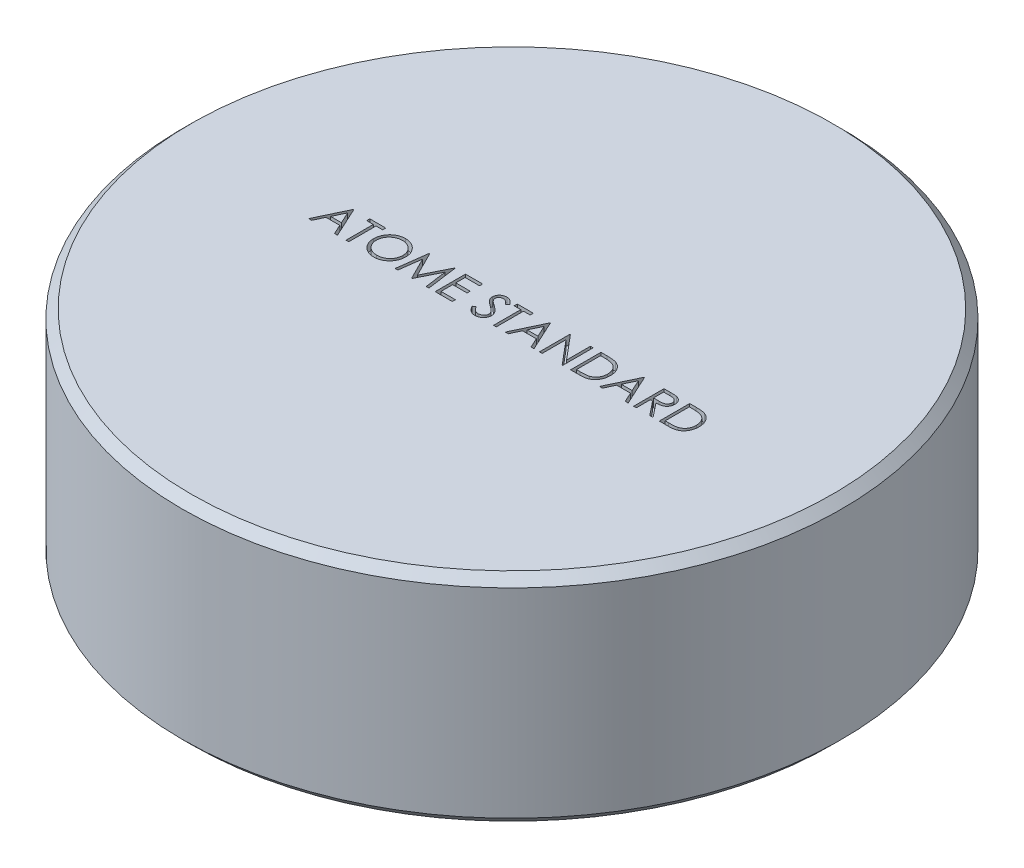
from build123d import *

# Parameters (mm, degrees)
ESQUISSE1_R             = 38
BOSS_EXTRU_1_DEPTH      = 25
CHANFREIN1_SIZE         = 1
CHANFREIN2_SIZE         = 1
ENL_V_MAT_EXTRU_1_DEPTH = 1
ENL_V_MAT_EXTRU_2_DEPTH = 1


with BuildPart() as part:
    # Esquisse1 → Boss.-Extru.1 (new body)
    with BuildSketch(Plane(origin=(0, 0, 0), x_dir=(1, 0, 0), z_dir=(0, 1, 0))):
        with Locations(Location((0, 0, 0), (0, 0, 270))):
            Circle(ESQUISSE1_R)
    extrude(amount=BOSS_EXTRU_1_DEPTH)

    # Chanfrein1
    chanfrein1_edges = [part.edges().sort_by_distance(p)[0] for p in [
        (0, 25, -38),
    ]]
    chamfer(chanfrein1_edges, length=CHANFREIN1_SIZE)

    # Chanfrein2
    chanfrein2_edges = [part.edges().sort_by_distance(p)[0] for p in [
        (0, 0, -38),
    ]]
    chamfer(chanfrein2_edges, length=CHANFREIN2_SIZE)

    # Esquisse2 → Enlèv. mat.-Extru.1 (cut)
    # profile 1 of 13: a face of its own
    with BuildSketch(Plane(origin=(0, 25, 0), x_dir=(1, 0, 0), z_dir=(0, 1, 0))):
        Polygon((-19.024411501, 0.795119678), (-17.409026885, -2.704880322), (-17.750473199, -2.704880322), (-18.267901084, -1.58308545), (-19.854539706, -1.58308545), (-20.386691148, -2.704880322), (-20.729539706, -2.704880322), (-19.069283295, 0.795119678), align=None)
        Polygon((-19.050353007, 0.112928171), (-19.68416711, -1.224111091), (-18.433365828, -1.224111091), align=None, mode=Mode.SUBTRACT)
    # profile 2 of 13: a face of its own
    with BuildSketch(Plane(origin=(0, 25, 0), x_dir=(1, 0, 0), z_dir=(0, 1, 0))):
        Polygon((-17.184667911, 0.436145319), (-17.184667911, 0.795119678), (-15.344924321, 0.795119678), (-15.344924321, 0.436145319), (-16.107744834, 0.436145319), (-16.107744834, -2.704880322), (-16.421847398, -2.704880322), (-16.421847398, 0.436145319), align=None)
    # profile 3 of 13: a face of its own
    with BuildSketch(Plane(origin=(0, 25, 0), x_dir=(1, 0, 0), z_dir=(0, 1, 0))):
        with BuildLine():
            add(Edge.make_bspline(
                [(-13.16864227, 0.884863268), (-13.103834164, 0.883221788), (-12.976545697, 0.879997787), (-12.789470799, 0.855318684), (-12.610875704, 0.812623294), (-12.439305565, 0.755760311), (-12.276812589, 0.679905926), (-12.122173696, 0.588220778), (-11.975756822, 0.479744319), (-11.839535441, 0.355315092), (-11.71487849, 0.219931638), (-11.605052604, 0.075453728), (-11.51301031, -0.077245074), (-11.437424523, -0.237705905), (-11.378125914, -0.405565873), (-11.33720687, -0.581719876), (-11.31106872, -0.765026566), (-11.308012942, -0.89005343), (-11.306462783, -0.953478079)],
                knots=[0, 0, 0, 0, 1.065120563, 2.091984664, 3.0946048, 4.079830382, 5.057816894, 6.036188127, 7.030412546, 8.04752943, 9.064399622, 10.05169764, 11.02544977, 11.989514704, 12.962713494, 13.945757189, 14.957906945, 16, 16, 16, 16], degree=3))
            add(Edge.make_bspline(
                [(-11.306462783, -0.953478079), (-11.308012715, -1.016435525), (-11.311067812, -1.140531945), (-11.337236589, -1.32267539), (-11.378277589, -1.497766086), (-11.436873855, -1.665511739), (-11.512099334, -1.826089303), (-11.604754505, -1.979076256), (-11.713895716, -2.124522755), (-11.838102567, -2.26083542), (-11.973503609, -2.385832891), (-12.118733876, -2.494751766), (-12.270527196, -2.588475891), (-12.430836904, -2.663259565), (-12.597536941, -2.723031485), (-12.772119264, -2.763784115), (-12.953765818, -2.790071159), (-13.077636821, -2.793089675), (-13.140597398, -2.794623912)],
                knots=[0, 0, 0, 0, 1.043624062, 2.057103931, 3.04512605, 4.022047818, 4.998200453, 5.980619268, 6.982898556, 8.009068085, 9.034988726, 10.034168286, 11.015286542, 11.987931943, 12.962482838, 13.94673481, 14.956375938, 16, 16, 16, 16], degree=3))
            add(Edge.make_bspline(
                [(-13.140597398, -2.794623912), (-13.204021717, -2.793074525), (-13.329047933, -2.790020271), (-13.512584968, -2.763838866), (-13.688862712, -2.722897563), (-13.857377063, -2.664388126), (-14.018221993, -2.588770896), (-14.171712076, -2.496566517), (-14.317231223, -2.387159375), (-14.453572969, -2.262992801), (-14.578322168, -2.127821249), (-14.687081543, -1.982986994), (-14.779306657, -1.831331537), (-14.854669989, -1.672434013), (-14.914334448, -1.50706257), (-14.955039267, -1.334114093), (-14.981375219, -1.154574587), (-14.984410065, -1.032331689), (-14.985949962, -0.970305002)],
                knots=[0, 0, 0, 0, 1.053102029, 2.075944431, 3.073151272, 4.055350789, 5.033113405, 6.020478099, 7.024410459, 8.052272461, 9.079885166, 10.07527673, 11.055994387, 12.023226415, 12.992069828, 13.970394897, 14.97016774, 16, 16, 16, 16], degree=3))
            add(Edge.make_bspline(
                [(-14.985949962, -0.970305002), (-14.985415327, -0.928672333), (-14.9843528, -0.845932209), (-14.971561108, -0.723065609), (-14.952999407, -0.602174951), (-14.926397494, -0.483604003), (-14.891605827, -0.367643018), (-14.8505538, -0.253492256), (-14.800413954, -0.142308532), (-14.743733306, -0.03356514), (-14.680471498, 0.071042766), (-14.610595749, 0.169922349), (-14.53656038, 0.263903346), (-14.455396987, 0.350550349), (-14.369780542, 0.432384006), (-14.278322163, 0.508146723), (-14.181579919, 0.578521674), (-14.079137539, 0.641942015), (-13.973519264, 0.69930115), (-13.864642487, 0.748523001), (-13.753985915, 0.790769062), (-13.641031267, 0.825009887), (-13.526078495, 0.852041923), (-13.40887671, 0.870449277), (-13.289519284, 0.883273595), (-13.209107965, 0.884331097), (-13.16864227, 0.884863268)],
                knots=[0, 0, 0, 0, 1.037015668, 2.060948919, 3.074880161, 4.083647147, 5.086022904, 6.090072063, 7.104153813, 8.122640571, 9.144368836, 10.147691507, 11.138137339, 12.123020368, 13.103399296, 14.087645067, 15.080126199, 16.082011238, 17.087798457, 18.072939717, 19.057185487, 20.037253025, 21.01195951, 21.997135196, 22.992090687, 24, 24, 24, 24], degree=3))
        make_face()
        with BuildLine():
            add(Edge.make_bspline(
                [(-13.15321759, 0.525888909), (-13.186432224, 0.525484018), (-13.252543957, 0.524678109), (-13.350828493, 0.514062393), (-13.447820427, 0.498932504), (-13.543539789, 0.477350983), (-13.637586078, 0.447946931), (-13.73083592, 0.414106022), (-13.822438973, 0.372884932), (-13.912092831, 0.326312227), (-13.999007906, 0.274763307), (-14.081020608, 0.21779154), (-14.158343252, 0.156732985), (-14.230786519, 0.091445148), (-14.298137691, 0.021595546), (-14.361722392, -0.05175689), (-14.418991974, -0.130708781), (-14.471477551, -0.213119188), (-14.518445391, -0.298880769), (-14.560210746, -0.387090631), (-14.594374754, -0.478468318), (-14.622237131, -0.572022476), (-14.645336942, -0.667604935), (-14.659970866, -0.765940784), (-14.670703225, -0.866535896), (-14.671463071, -0.93451775), (-14.671847398, -0.968902758)],
                knots=[0, 0, 0, 0, 1.008559885, 2.007477868, 2.99961109, 3.989939068, 4.984837346, 5.991145699, 7.001802488, 8.033829008, 9.059044045, 10.069351652, 11.065060232, 12.050310815, 13.029377138, 14.011219647, 14.996725999, 15.989392538, 16.977580475, 17.965360261, 18.951710183, 19.937753436, 20.929683414, 21.935841486, 22.955955122, 24, 24, 24, 24], degree=3))
            add(Edge.make_bspline(
                [(-14.671847398, -0.968902758), (-14.670572536, -1.019464979), (-14.668064488, -1.118936509), (-14.646106918, -1.264704653), (-14.612284944, -1.404792939), (-14.562427577, -1.538434849), (-14.500076963, -1.666779131), (-14.423050072, -1.788687236), (-14.331790987, -1.904192111), (-14.22812746, -2.01248738), (-14.114804753, -2.111333184), (-13.994472024, -2.198096592), (-13.868418416, -2.271506842), (-13.736315213, -2.331311915), (-13.598867674, -2.378701652), (-13.455190123, -2.411180284), (-13.306239664, -2.432555739), (-13.204709009, -2.434608495), (-13.15321759, -2.435649553)],
                knots=[0, 0, 0, 0, 1.032063989, 2.030389145, 3.003944642, 3.970395727, 4.937377036, 5.913328081, 6.909231446, 7.93887556, 8.970685674, 9.976071282, 10.964166581, 11.944589148, 12.933237628, 13.927779006, 14.949070134, 16, 16, 16, 16], degree=3))
            add(Edge.make_bspline(
                [(-13.15321759, -2.435649553), (-13.118608089, -2.435174049), (-13.049967052, -2.434230981), (-12.94787153, -2.424732304), (-12.847615318, -2.409500434), (-12.749339038, -2.387569779), (-12.653154227, -2.360122572), (-12.558659424, -2.327514844), (-12.466861134, -2.286833641), (-12.376601296, -2.241885689), (-12.290205054, -2.190645532), (-12.207729522, -2.135607382), (-12.131253542, -2.074638761), (-12.05886447, -2.010320949), (-11.991236781, -1.941357101), (-11.928827797, -1.867836879), (-11.871847665, -1.789296222), (-11.819382019, -1.707010816), (-11.772578756, -1.621014563), (-11.731799657, -1.532484885), (-11.697203541, -1.441639776), (-11.669275036, -1.348348204), (-11.647389574, -1.252787356), (-11.632309654, -1.154829278), (-11.621761216, -1.054669935), (-11.620966139, -0.986926079), (-11.620565347, -0.952776957)],
                knots=[0, 0, 0, 0, 1.047197238, 2.076906641, 3.100256066, 4.114471768, 5.12198147, 6.126382909, 7.136867548, 8.15857795, 9.17633901, 10.174870724, 11.156907918, 12.133735059, 13.104061851, 14.077631395, 15.04955518, 16.038496417, 17.029181396, 18.010275684, 18.986308667, 19.968651475, 20.955262928, 21.950658345, 22.966943676, 24, 24, 24, 24], degree=3))
            add(Edge.make_bspline(
                [(-11.620565347, -0.952776957), (-11.62096646, -0.918861453), (-11.621762141, -0.851583802), (-11.632304616, -0.752122984), (-11.647405506, -0.654869773), (-11.669168214, -0.56020597), (-11.697218368, -0.468107444), (-11.731805698, -0.378660697), (-11.772590998, -0.291532502), (-11.819399222, -0.206938205), (-11.872015046, -0.125763467), (-11.929509289, -0.048161054), (-11.992874637, 0.024411687), (-12.060300662, 0.093746381), (-12.133471547, 0.158364271), (-12.212055841, 0.218286791), (-12.295099519, 0.274960066), (-12.383026755, 0.326085628), (-12.473770708, 0.37329986), (-12.566884666, 0.413750863), (-12.661313766, 0.448122983), (-12.756817878, 0.477439948), (-12.854200857, 0.498847978), (-12.952804685, 0.514076028), (-13.052492944, 0.524674414), (-13.119536164, 0.525482792), (-13.15321759, 0.525888909)],
                knots=[0, 0, 0, 0, 1.02996197, 2.043119294, 3.035359645, 4.018872909, 4.991431989, 5.957985074, 6.929999688, 7.912076566, 8.892894881, 9.867085534, 10.843653904, 11.817741046, 12.803660682, 13.806313499, 14.818574707, 15.856120519, 16.894564902, 17.924820532, 18.937903209, 19.946497019, 20.957711757, 21.963978472, 22.977135795, 24, 24, 24, 24], degree=3))
        make_face(mode=Mode.SUBTRACT)
    # profile 4 of 13: a face of its own
    with BuildSketch(Plane(origin=(0, 25, 0), x_dir=(1, 0, 0), z_dir=(0, 1, 0))):
        Polygon((-10.768001244, -2.704880322), (-10.305961981, 0.795119678), (-10.261090186, 0.795119678), (-8.816078167, -2.076675194), (-7.374571757, 0.795119678), (-7.32899884, 0.795119678), (-6.86415509, -2.704880322), (-7.179659898, -2.704880322), (-7.514796116, -0.186450835), (-8.77821759, -2.704880322), (-8.849030892, -2.704880322), (-10.117360219, -0.180841861), (-10.451795315, -2.704880322), align=None)
    # profile 5 of 13: a face of its own
    with BuildSketch(Plane(origin=(0, 25, 0), x_dir=(1, 0, 0), z_dir=(0, 1, 0))):
        Polygon((-6.146206372, 0.795119678), (-4.171847398, 0.795119678), (-4.171847398, 0.436145319), (-5.832103808, 0.436145319), (-5.832103808, -0.640777758), (-4.171847398, -0.640777758), (-4.171847398, -0.999752117), (-5.832103808, -0.999752117), (-5.832103808, -2.345905963), (-4.171847398, -2.345905963), (-4.171847398, -2.704880322), (-6.146206372, -2.704880322), align=None)
    # profile 6 of 13: a face of its own
    with BuildSketch(Plane(origin=(0, 25, 0), x_dir=(1, 0, 0), z_dir=(0, 1, 0))):
        with BuildLine():
            Line((-2.556462783, -2.029700034), (-2.260589385, -1.85231622))
            add(Edge.make_bspline(
                [(-2.260589385, -1.85231622), (-2.233071148, -1.898380605), (-2.180347267, -1.986638188), (-2.092395908, -2.105896229), (-2.001262997, -2.207258386), (-1.906273663, -2.290134993), (-1.808007715, -2.35538388), (-1.705823662, -2.401586112), (-1.600065851, -2.430402087), (-1.528092029, -2.433902174), (-1.492159898, -2.435649553)],
                knots=[0, 0, 0, 0, 1.272034388, 2.437168799, 3.508375237, 4.49857839, 5.41946034, 6.295179144, 7.148887113, 8, 8, 8, 8], degree=3))
            add(Edge.make_bspline(
                [(-1.492159898, -2.435649553), (-1.461473038, -2.43479488), (-1.400636264, -2.43310049), (-1.311074021, -2.416819688), (-1.224092219, -2.391807559), (-1.141483581, -2.355986628), (-1.064387967, -2.312648142), (-0.996781272, -2.260301964), (-0.938335158, -2.201695759), (-0.890526044, -2.136313104), (-0.853846009, -2.065995955), (-0.82565394, -1.993820004), (-0.810008867, -1.918651436), (-0.807652113, -1.868040973), (-0.806462783, -1.842500514)],
                knots=[0, 0, 0, 0, 1.095163259, 2.171163733, 3.241058638, 4.321873601, 5.38011039, 6.391990106, 7.366004449, 8.327778327, 9.272591725, 10.192022065, 11.087607919, 12, 12, 12, 12], degree=3))
            add(Edge.make_bspline(
                [(-0.806462783, -1.842500514), (-0.807937093, -1.813359665), (-0.810934152, -1.754120576), (-0.836265632, -1.666720923), (-0.876114878, -1.580228353), (-0.912877522, -1.526727087), (-0.931963584, -1.498950835)],
                knots=[0, 0, 0, 0, 0.938893495, 1.908633276, 2.914225137, 4, 4, 4, 4], degree=3))
            add(Edge.make_bspline(
                [(-0.931963584, -1.498950835), (-0.947634198, -1.478904011), (-0.980532692, -1.436818213), (-1.037090205, -1.374172977), (-1.103456319, -1.309554558), (-1.177359874, -1.240495501), (-1.261492963, -1.170207705), (-1.353220477, -1.095339427), (-1.454884336, -1.01873785), (-1.526183833, -0.967365284), (-1.562973199, -0.940857886)],
                knots=[0, 0, 0, 0, 0.722233717, 1.516239348, 2.393582979, 3.351407094, 4.387010283, 5.505090956, 6.712668013, 8, 8, 8, 8], degree=3))
            add(Edge.make_bspline(
                [(-1.562973199, -0.940857886), (-1.599797195, -0.914629299), (-1.670201872, -0.864482236), (-1.768660454, -0.790057952), (-1.856704917, -0.722014083), (-1.933943934, -0.659710071), (-2.000343531, -0.603137466), (-2.056426942, -0.552839527), (-2.100765499, -0.507455966), (-2.12542108, -0.478014624), (-2.136490828, -0.464796188)],
                knots=[0, 0, 0, 0, 1.452282411, 2.77665338, 3.964542531, 5.026858415, 5.96415736, 6.766646006, 7.446254459, 8, 8, 8, 8], degree=3))
            add(Edge.make_bspline(
                [(-2.136490828, -0.464796188), (-2.151963373, -0.444195151), (-2.182392209, -0.403680447), (-2.222558215, -0.340355589), (-2.256697378, -0.275532324), (-2.28345971, -0.209036459), (-2.305995929, -0.14180153), (-2.321153859, -0.072950285), (-2.330645256, -0.002791666), (-2.331617243, 0.044421834), (-2.332103808, 0.068056377)],
                knots=[0, 0, 0, 0, 1.068054152, 2.10047183, 3.106115577, 4.101338837, 5.06977816, 6.043150881, 7.020423561, 8, 8, 8, 8], degree=3))
            add(Edge.make_bspline(
                [(-2.332103808, 0.068056377), (-2.330798599, 0.105086151), (-2.328216079, 0.178354215), (-2.306375562, 0.285385045), (-2.271902668, 0.387571463), (-2.22360778, 0.483901796), (-2.161350428, 0.571867777), (-2.089304453, 0.652481264), (-2.003492967, 0.720249846), (-1.909340344, 0.779461905), (-1.806283972, 0.82580783), (-1.698293068, 0.86076881), (-1.585195996, 0.880578068), (-1.508592862, 0.883420833), (-1.469724001, 0.884863268)],
                knots=[0, 0, 0, 0, 1.005424448, 1.989358655, 2.955360095, 3.929531133, 4.905563448, 5.876582895, 6.856512386, 7.866279853, 8.892233794, 9.918561126, 10.94386622, 12, 12, 12, 12], degree=3))
            add(Edge.make_bspline(
                [(-1.469724001, 0.884863268), (-1.4284799, 0.883440716), (-1.346458549, 0.880611715), (-1.225809333, 0.856014184), (-1.109648617, 0.815313512), (-1.016205352, 0.769124854), (-0.94307259, 0.722993438), (-0.887299858, 0.680973614), (-0.830782407, 0.632598505), (-0.773064352, 0.577739259), (-0.715123693, 0.515892508), (-0.65610024, 0.447481819), (-0.595855971, 0.372925263), (-0.557100111, 0.319700762), (-0.537232013, 0.292415351)],
                knots=[0, 0, 0, 0, 1.286793592, 2.559021753, 3.825965368, 5.121522368, 5.803751409, 6.523245864, 7.299691795, 8.125521123, 9.008227632, 9.944561021, 10.946284179, 12, 12, 12, 12], degree=3))
            Line((-0.537232013, 0.292415351), (-0.82118634, 0.07717096))
            add(Edge.make_bspline(
                [(-0.82118634, 0.07717096), (-0.838332273, 0.09925965), (-0.87135133, 0.141797304), (-0.921480817, 0.201368619), (-0.968729465, 0.255785099), (-1.015279864, 0.303050227), (-1.058673496, 0.34575236), (-1.100790538, 0.382312117), (-1.141024889, 0.413087712), (-1.1917418, 0.445931272), (-1.255459518, 0.478487776), (-1.335444055, 0.506036854), (-1.41903033, 0.522591916), (-1.475959961, 0.524780803), (-1.50478009, 0.525888909)],
                knots=[0, 0, 0, 0, 1.181633172, 2.275549214, 3.290209073, 4.226197932, 5.078386478, 5.862611352, 6.581680152, 7.217281963, 8.414376989, 9.595101626, 10.782541182, 12, 12, 12, 12], degree=3))
            add(Edge.make_bspline(
                [(-1.50478009, 0.525888909), (-1.540936613, 0.524677209), (-1.61066106, 0.522340559), (-1.709651296, 0.496820574), (-1.798745221, 0.456638714), (-1.875297786, 0.400323736), (-1.939034763, 0.333602743), (-1.985140222, 0.256823888), (-2.012890387, 0.172041485), (-2.016276666, 0.112899829), (-2.018001244, 0.082779934)],
                knots=[0, 0, 0, 0, 1.14458467, 2.207223713, 3.21896685, 4.227309161, 5.202851033, 6.127160689, 7.046193047, 8, 8, 8, 8], degree=3))
            add(Edge.make_bspline(
                [(-2.018001244, 0.082779934), (-2.017608118, 0.064028456), (-2.016821221, 0.026494836), (-2.005846424, -0.028956586), (-1.991747095, -0.084267925), (-1.969404463, -0.139190508), (-1.938559159, -0.194684867), (-1.898053984, -0.251706605), (-1.847040671, -0.310758313), (-1.807963659, -0.349165687), (-1.787332174, -0.369443623)],
                knots=[0, 0, 0, 0, 0.858281714, 1.717966888, 2.583508476, 3.4729293, 4.427298488, 5.488583878, 6.674047936, 8, 8, 8, 8], degree=3))
            add(Edge.make_bspline(
                [(-1.787332174, -0.369443623), (-1.779670801, -0.376280649), (-1.761469134, -0.392523858), (-1.728193208, -0.419116138), (-1.68425041, -0.451918911), (-1.630788209, -0.492506227), (-1.566820847, -0.539587689), (-1.492341291, -0.592561301), (-1.408179758, -0.65314676), (-1.348457842, -0.695504301), (-1.316879449, -0.717901156)],
                knots=[0, 0, 0, 0, 0.420754252, 0.999615792, 1.744751191, 2.668019286, 3.750313428, 4.999500688, 6.413464383, 8, 8, 8, 8], degree=3))
            add(Edge.make_bspline(
                [(-1.316879449, -0.717901156), (-1.278893536, -0.745542515), (-1.20533908, -0.799066177), (-1.1006815, -0.879481857), (-1.005787692, -0.958129625), (-0.920324488, -1.034507233), (-0.84344758, -1.108035326), (-0.776009859, -1.179598506), (-0.717324179, -1.248684079), (-0.65414496, -1.337256654), (-0.589587141, -1.446037738), (-0.534145633, -1.579315977), (-0.499187286, -1.713112298), (-0.49461577, -1.803039134), (-0.492360219, -1.847408367)],
                knots=[0, 0, 0, 0, 1.163667725, 2.253281268, 3.268753668, 4.215851969, 5.092017293, 5.902905408, 6.650798638, 7.335211899, 8.59617414, 9.77448103, 10.901945474, 12, 12, 12, 12], degree=3))
            add(Edge.make_bspline(
                [(-0.492360219, -1.847408367), (-0.493017357, -1.878786732), (-0.494318872, -1.940934116), (-0.509279785, -2.032189193), (-0.531199451, -2.120820062), (-0.564236685, -2.205731175), (-0.604559843, -2.288475937), (-0.655726091, -2.366883838), (-0.715033775, -2.442690236), (-0.78306754, -2.513873728), (-0.857513443, -2.579219924), (-0.936197137, -2.637348985), (-1.01924741, -2.685817309), (-1.106213727, -2.725368151), (-1.197116064, -2.756301668), (-1.291923848, -2.778714537), (-1.390793359, -2.792470248), (-1.45799384, -2.79389801), (-1.492159898, -2.794623912)],
                knots=[0, 0, 0, 0, 0.983748083, 1.948392443, 2.894712957, 3.844097841, 4.80183111, 5.778335162, 6.776009319, 7.81870978, 8.863265674, 9.881300176, 10.883814829, 11.87499822, 12.874611388, 13.892143829, 14.928324115, 16, 16, 16, 16], degree=3))
            add(Edge.make_bspline(
                [(-1.492159898, -2.794623912), (-1.518595241, -2.79411273), (-1.571133001, -2.793096805), (-1.648842483, -2.784115525), (-1.724982072, -2.771408421), (-1.798596354, -2.751234351), (-1.870633766, -2.726757374), (-1.940781, -2.696619041), (-2.009072054, -2.66050184), (-2.075889637, -2.619206815), (-2.141063812, -2.571149071), (-2.20398328, -2.515175574), (-2.266712465, -2.452830069), (-2.327399861, -2.382419506), (-2.387273006, -2.305081423), (-2.445151415, -2.22009224), (-2.502233133, -2.127914886), (-2.538048601, -2.0630498), (-2.556462783, -2.029700034)],
                knots=[0, 0, 0, 0, 0.915332311, 1.819136955, 2.706846663, 3.586547465, 4.459518054, 5.340707479, 6.227863349, 7.133153174, 8.059268498, 9.028702269, 10.047606654, 11.120612155, 12.245963614, 13.433783089, 14.680604001, 16, 16, 16, 16], degree=3))
        make_face()
    # profile 7 of 13: a face of its own
    with BuildSketch(Plane(origin=(0, 25, 0), x_dir=(1, 0, 0), z_dir=(0, 1, 0))):
        Polygon((-0.178257654, 0.436145319), (-0.178257654, 0.795119678), (1.661485935, 0.795119678), (1.661485935, 0.436145319), (0.898665422, 0.436145319), (0.898665422, -2.704880322), (0.584562858, -2.704880322), (0.584562858, 0.436145319), align=None)
    # profile 8 of 13: a face of its own
    with BuildSketch(Plane(origin=(0, 25, 0), x_dir=(1, 0, 0), z_dir=(0, 1, 0))):
        Polygon((3.63584491, 0.795119678), (5.251229525, -2.704880322), (4.909783211, -2.704880322), (4.392355326, -1.58308545), (2.805716705, -1.58308545), (2.273565262, -2.704880322), (1.930716705, -2.704880322), (3.590973115, 0.795119678), align=None)
        Polygon((3.609903403, 0.112928171), (2.976089301, -1.224111091), (4.226890583, -1.224111091), align=None, mode=Mode.SUBTRACT)
    # profile 9 of 13: a face of its own
    with BuildSketch(Plane(origin=(0, 25, 0), x_dir=(1, 0, 0), z_dir=(0, 1, 0))):
        Polygon((5.879434653, -2.704880322), (5.879434653, 0.795119678), (5.945340102, 0.795119678), (8.257639781, -1.959587854), (8.257639781, 0.795119678), (8.571742346, 0.795119678), (8.571742346, -2.704880322), (8.500227922, -2.704880322), (6.193537217, 0.043517114), (6.193537217, -2.704880322), align=None)
    # profile 10 of 13: a face of its own
    with BuildSketch(Plane(origin=(0, 25, 0), x_dir=(1, 0, 0), z_dir=(0, 1, 0))):
        with BuildLine():
            Line((9.469178243, -2.704880322), (9.469178243, 0.795119678))
            Line((9.469178243, 0.795119678), (10.175909012, 0.795119678))
            add(Edge.make_bspline(
                [(10.175909012, 0.795119678), (10.237378, 0.794677108), (10.356135766, 0.793822065), (10.527748213, 0.788400674), (10.686531976, 0.778810208), (10.831964835, 0.764840682), (10.964446047, 0.747687648), (11.083604655, 0.726187244), (11.190056798, 0.700799073), (11.255526238, 0.679153623), (11.286485935, 0.668917755)],
                knots=[0, 0, 0, 0, 1.314313732, 2.53924729, 3.670748893, 4.714932338, 5.66265055, 6.526160246, 7.303039223, 8, 8, 8, 8], degree=3))
            add(Edge.make_bspline(
                [(11.286485935, 0.668917755), (11.326980675, 0.653487049), (11.407051867, 0.622975555), (11.521058989, 0.565419254), (11.628384352, 0.500206152), (11.729603497, 0.427250289), (11.822404324, 0.344485941), (11.91041222, 0.255428855), (11.990026944, 0.156840515), (12.06293524, 0.050765527), (12.1286709, -0.061546525), (12.185810058, -0.179881634), (12.233264051, -0.303638842), (12.272657278, -0.43247399), (12.303703735, -0.566670368), (12.324885667, -0.706384234), (12.338856657, -0.851063423), (12.340260708, -0.949237887), (12.340973115, -0.999050995)],
                knots=[0, 0, 0, 0, 0.984719456, 1.947108742, 2.898477687, 3.838006223, 4.779231079, 5.722358779, 6.681677486, 7.655904652, 8.64651281, 9.637519902, 10.640069247, 11.656948941, 12.698408672, 13.768548281, 14.867775369, 16, 16, 16, 16], degree=3))
            add(Edge.make_bspline(
                [(12.340973115, -0.999050995), (12.340344147, -1.042312234), (12.339104701, -1.127563023), (12.327975385, -1.253203918), (12.311799065, -1.37511749), (12.286754867, -1.49272319), (12.256352354, -1.607051408), (12.217388203, -1.716883652), (12.172752707, -1.823227461), (12.120702828, -1.924644937), (12.063561443, -2.020728309), (12.0022397, -2.111303838), (11.936803004, -2.195079059), (11.866627371, -2.272307671), (11.792619655, -2.34287325), (11.714295324, -2.407365265), (11.631452274, -2.46452182), (11.544461551, -2.516588928), (11.450785422, -2.562009284), (11.348649556, -2.600439294), (11.237618378, -2.632285909), (11.117964421, -2.658856805), (10.989480943, -2.679934107), (10.852041977, -2.6940605), (10.705858687, -2.703613433), (10.605479422, -2.704449826), (10.55381366, -2.704880322)],
                knots=[0, 0, 0, 0, 1.105936401, 2.179363191, 3.223086493, 4.248585256, 5.251745608, 6.245858792, 7.225916811, 8.198733463, 9.158002045, 10.082870192, 10.993790845, 11.873723703, 12.748670949, 13.606408763, 14.465103618, 15.319838547, 16.196477973, 17.123216899, 18.106603292, 19.147568657, 20.255746949, 21.433717677, 22.679120308, 24, 24, 24, 24], degree=3))
            Line((10.55381366, -2.704880322), (9.469178243, -2.704880322))
        make_face()
        with BuildLine():
            Line((9.783280807, -2.345905963), (10.185023596, -2.345905963))
            add(Edge.make_bspline(
                [(10.185023596, -2.345905963), (10.242751966, -2.345657867), (10.353784765, -2.345180687), (10.513442762, -2.340993484), (10.659322158, -2.334151546), (10.791443668, -2.324576468), (10.909732692, -2.311907853), (11.014436442, -2.29778295), (11.1052117, -2.280185499), (11.160141137, -2.26423454), (11.185524397, -2.256863495)],
                knots=[0, 0, 0, 0, 1.375205317, 2.645023457, 3.804390687, 4.853969522, 5.800190428, 6.637939096, 7.370582563, 8, 8, 8, 8], degree=3))
            add(Edge.make_bspline(
                [(11.185524397, -2.256863495), (11.217472759, -2.245611937), (11.280606397, -2.223377564), (11.371487482, -2.182819903), (11.456244487, -2.134777833), (11.536354512, -2.081375559), (11.610681168, -2.020729557), (11.680105284, -1.954158568), (11.744487085, -1.881323793), (11.803161393, -1.802315631), (11.855669697, -1.717625836), (11.901140927, -1.628087002), (11.940992458, -1.534680192), (11.972271051, -1.435971033), (11.996786635, -1.332841975), (12.014151323, -1.225285762), (12.024966048, -1.11332248), (12.026227496, -1.037170355), (12.026870551, -0.998349873)],
                knots=[0, 0, 0, 0, 0.998632004, 1.973411704, 2.929992603, 3.868527914, 4.809262121, 5.754881198, 6.702106254, 7.672490631, 8.653608572, 9.636854334, 10.631411391, 11.644891563, 12.686317036, 13.754757253, 14.855430412, 16, 16, 16, 16], degree=3))
            add(Edge.make_bspline(
                [(12.026870551, -0.998349873), (12.026357263, -0.957416393), (12.025348906, -0.877002209), (12.012674595, -0.759011514), (11.99415304, -0.645530863), (11.967369354, -0.536552668), (11.933238475, -0.431864315), (11.890643833, -0.332044805), (11.841977214, -0.236039936), (11.784073877, -0.146065571), (11.720658284, -0.060972461), (11.650280404, 0.016982454), (11.574058366, 0.087976754), (11.492823516, 0.153116067), (11.404286417, 0.209779743), (11.310532726, 0.260466424), (11.210187055, 0.303482315), (11.140374359, 0.326361178), (11.10489539, 0.337988268)],
                knots=[0, 0, 0, 0, 1.122418816, 2.205001699, 3.251619955, 4.274784885, 5.280384055, 6.268708349, 7.249350384, 8.229342522, 9.199999885, 10.157847722, 11.105861043, 12.055065948, 13.010012805, 13.98527497, 14.976112212, 16, 16, 16, 16], degree=3))
            add(Edge.make_bspline(
                [(11.10489539, 0.337988268), (11.075544244, 0.346104695), (11.013135654, 0.363362448), (10.91129619, 0.382187821), (10.79668104, 0.39879232), (10.668781339, 0.412850359), (10.52774288, 0.42293768), (10.373457192, 0.430508995), (10.205857588, 0.435615627), (10.089675054, 0.435964335), (10.029374557, 0.436145319)],
                knots=[0, 0, 0, 0, 0.674548936, 1.434276114, 2.292660221, 3.240891867, 4.284742987, 5.42552168, 6.663806718, 8, 8, 8, 8], degree=3))
            Line((10.029374557, 0.436145319), (9.783280807, 0.436145319))
            Line((9.783280807, 0.436145319), (9.783280807, -2.345905963))
        make_face(mode=Mode.SUBTRACT)
    # profile 11 of 13: a face of its own
    with BuildSketch(Plane(origin=(0, 25, 0), x_dir=(1, 0, 0), z_dir=(0, 1, 0))):
        Polygon((14.494819269, 0.795119678), (16.110203884, -2.704880322), (15.76875757, -2.704880322), (15.251329685, -1.58308545), (13.664691064, -1.58308545), (13.132539621, -2.704880322), (12.789691064, -2.704880322), (14.449947474, 0.795119678), align=None)
        Polygon((14.468877762, 0.112928171), (13.83506366, -1.224111091), (15.085864942, -1.224111091), align=None, mode=Mode.SUBTRACT)
    # profile 12 of 13: a face of its own
    with BuildSketch(Plane(origin=(0, 25, 0), x_dir=(1, 0, 0), z_dir=(0, 1, 0))):
        with BuildLine():
            Line((16.738409012, 0.795119678), (17.438829685, 0.795119678))
            add(Edge.make_bspline(
                [(17.438829685, 0.795119678), (17.485570814, 0.794964092), (17.575318958, 0.79466535), (17.703892229, 0.792999587), (17.820719326, 0.788225231), (17.925739165, 0.784116647), (18.01894982, 0.776624706), (18.100637111, 0.769464059), (18.170424808, 0.760090398), (18.212670659, 0.751384975), (18.231798435, 0.747443396)],
                knots=[0, 0, 0, 0, 1.410062039, 2.707475311, 3.878576406, 4.937260626, 5.877586885, 6.699081471, 7.410979367, 8, 8, 8, 8], degree=3))
            add(Edge.make_bspline(
                [(18.231798435, 0.747443396), (18.257405059, 0.74111663), (18.308072049, 0.728598067), (18.381022115, 0.702138466), (18.450536439, 0.671518841), (18.516326263, 0.635555121), (18.578062054, 0.593980341), (18.636380365, 0.547512219), (18.691545829, 0.496405013), (18.741327459, 0.439370172), (18.78826651, 0.379533662), (18.827855137, 0.314829905), (18.861981617, 0.247168378), (18.889152134, 0.17586096), (18.911030107, 0.101599188), (18.926456347, 0.023710391), (18.935707534, -0.057450584), (18.93664939, -0.112808493), (18.937126961, -0.140877918)],
                knots=[0, 0, 0, 0, 1.027469482, 2.033020251, 3.019912614, 3.986113645, 4.951240523, 5.91722682, 6.890402269, 7.87763091, 8.8651537, 9.85103654, 10.82876324, 11.815024772, 12.821070561, 13.842952187, 14.906261191, 16, 16, 16, 16], degree=3))
            add(Edge.make_bspline(
                [(18.937126961, -0.140877918), (18.935657963, -0.187513023), (18.932791567, -0.278510191), (18.906066463, -0.410571072), (18.862289944, -0.533760387), (18.801966655, -0.647923025), (18.725147179, -0.75083367), (18.632822388, -0.841224125), (18.524940776, -0.916864038), (18.42451146, -0.969316843), (18.335797261, -1.002909751), (18.262763948, -1.02654611), (18.18309697, -1.044808076), (18.097559636, -1.061168207), (18.00579598, -1.073519902), (17.908025941, -1.082566496), (17.804179789, -1.088220545), (17.73284072, -1.08906255), (17.696141384, -1.089495707)],
                knots=[0, 0, 0, 0, 1.260483769, 2.459530307, 3.627416485, 4.787058657, 5.939039949, 7.08810263, 8.267026773, 9.491475466, 10.141966685, 10.831826277, 11.566392101, 12.351337768, 13.187381173, 14.07005841, 15.007169909, 16, 16, 16, 16], degree=3))
            Line((17.696141384, -1.089495707), (18.981998756, -2.704880322))
            Line((18.981998756, -2.704880322), (18.593577281, -2.704880322))
            Line((18.593577281, -2.704880322), (17.30771991, -1.089495707))
            Line((17.30771991, -1.089495707), (17.052511576, -1.089495707))
            Line((17.052511576, -1.089495707), (17.052511576, -2.704880322))
            Line((17.052511576, -2.704880322), (16.738409012, -2.704880322))
            Line((16.738409012, -2.704880322), (16.738409012, 0.795119678))
        make_face()
        with BuildLine():
            Line((17.052511576, 0.436145319), (17.052511576, -0.730521348))
            Line((17.052511576, -0.730521348), (17.693336897, -0.7354292))
            add(Edge.make_bspline(
                [(17.693336897, -0.7354292), (17.723256936, -0.735442437), (17.781250493, -0.735468093), (17.865151158, -0.731474317), (17.943271269, -0.726930999), (18.015312022, -0.719981653), (18.081305597, -0.711025582), (18.14121901, -0.699822597), (18.195150062, -0.686770535), (18.2580486, -0.666568909), (18.328285132, -0.634562891), (18.404616592, -0.587997392), (18.469618929, -0.529428273), (18.524536792, -0.462454817), (18.568666223, -0.388818568), (18.599778278, -0.309402199), (18.61952072, -0.226210601), (18.621849265, -0.169032493), (18.623024397, -0.140176797)],
                knots=[0, 0, 0, 0, 1.146690395, 2.22261258, 3.21895312, 4.145990853, 4.996080663, 5.770904154, 6.481378293, 7.121626537, 8.300444488, 9.431385265, 10.535395872, 11.636531494, 12.74115979, 13.810798291, 14.895190096, 16, 16, 16, 16], degree=3))
            add(Edge.make_bspline(
                [(18.623024397, -0.140176797), (18.621822276, -0.112030223), (18.61944011, -0.056253984), (18.599991342, 0.025401926), (18.567101961, 0.102468876), (18.522779723, 0.174633361), (18.468780568, 0.240139097), (18.405462755, 0.29618625), (18.33455756, 0.342435715), (18.268286361, 0.371990095), (18.209052149, 0.390109949), (18.157622489, 0.402861112), (18.099511011, 0.413105581), (18.034435553, 0.421313642), (17.962673922, 0.428368587), (17.883863271, 0.433120365), (17.79852649, 0.435934229), (17.739379559, 0.436073318), (17.708761576, 0.436145319)],
                knots=[0, 0, 0, 0, 1.101028733, 2.181837193, 3.264309656, 4.369019818, 5.486613113, 6.575447106, 7.666700264, 8.788928104, 9.402425223, 10.0903467, 10.862060571, 11.710948788, 12.657782767, 13.684531032, 14.801375019, 16, 16, 16, 16], degree=3))
            Line((17.708761576, 0.436145319), (17.052511576, 0.436145319))
        make_face(mode=Mode.SUBTRACT)
    # profile 13 of 13: a face of its own
    with BuildSketch(Plane(origin=(0, 25, 0), x_dir=(1, 0, 0), z_dir=(0, 1, 0))):
        with BuildLine():
            Line((19.699947474, -2.704880322), (19.699947474, 0.795119678))
            Line((19.699947474, 0.795119678), (20.406678243, 0.795119678))
            add(Edge.make_bspline(
                [(20.406678243, 0.795119678), (20.468147231, 0.794677108), (20.586904997, 0.793822065), (20.758517444, 0.788400674), (20.917301206, 0.778810208), (21.062734066, 0.764840682), (21.195215278, 0.747687648), (21.314373886, 0.726187244), (21.420826029, 0.700799073), (21.486295469, 0.679153623), (21.517255166, 0.668917755)],
                knots=[0, 0, 0, 0, 1.314313732, 2.53924729, 3.670748893, 4.714932338, 5.66265055, 6.526160246, 7.303039223, 8, 8, 8, 8], degree=3))
            add(Edge.make_bspline(
                [(21.517255166, 0.668917755), (21.557749905, 0.653487049), (21.637821098, 0.622975555), (21.75182822, 0.565419254), (21.859153583, 0.500206152), (21.960372728, 0.427250289), (22.053173554, 0.344485941), (22.141181451, 0.255428855), (22.220796175, 0.156840515), (22.293704471, 0.050765527), (22.359440131, -0.061546525), (22.416579288, -0.179881634), (22.464033282, -0.303638842), (22.503426508, -0.43247399), (22.534472966, -0.566670368), (22.555654898, -0.706384234), (22.569625887, -0.851063423), (22.571029939, -0.949237887), (22.571742346, -0.999050995)],
                knots=[0, 0, 0, 0, 0.984719456, 1.947108742, 2.898477687, 3.838006223, 4.779231079, 5.722358779, 6.681677486, 7.655904652, 8.64651281, 9.637519902, 10.640069247, 11.656948941, 12.698408672, 13.768548281, 14.867775369, 16, 16, 16, 16], degree=3))
            add(Edge.make_bspline(
                [(22.571742346, -0.999050995), (22.571113378, -1.042312234), (22.569873932, -1.127563023), (22.558744616, -1.253203918), (22.542568296, -1.37511749), (22.517524098, -1.49272319), (22.487121585, -1.607051408), (22.448157434, -1.716883652), (22.403521937, -1.823227461), (22.351472059, -1.924644937), (22.294330674, -2.020728309), (22.233008931, -2.111303838), (22.167572235, -2.195079059), (22.097396602, -2.272307671), (22.023388886, -2.34287325), (21.945064555, -2.407365265), (21.862221504, -2.46452182), (21.775230782, -2.516588928), (21.681554653, -2.562009284), (21.579418786, -2.600439294), (21.468387608, -2.632285909), (21.348733651, -2.658856805), (21.220250174, -2.679934107), (21.082811208, -2.6940605), (20.936627918, -2.703613433), (20.836248653, -2.704449826), (20.78458289, -2.704880322)],
                knots=[0, 0, 0, 0, 1.105936401, 2.179363191, 3.223086493, 4.248585256, 5.251745608, 6.245858792, 7.225916811, 8.198733463, 9.158002045, 10.082870192, 10.993790845, 11.873723703, 12.748670949, 13.606408763, 14.465103618, 15.319838547, 16.196477973, 17.123216899, 18.106603292, 19.147568657, 20.255746949, 21.433717677, 22.679120308, 24, 24, 24, 24], degree=3))
            Line((20.78458289, -2.704880322), (19.699947474, -2.704880322))
        make_face()
        with BuildLine():
            Line((20.014050038, -2.345905963), (20.415792826, -2.345905963))
            add(Edge.make_bspline(
                [(20.415792826, -2.345905963), (20.473521197, -2.345657867), (20.584553995, -2.345180687), (20.744211993, -2.340993484), (20.890091389, -2.334151546), (21.022212899, -2.324576468), (21.140501923, -2.311907853), (21.245205673, -2.29778295), (21.335980931, -2.280185499), (21.390910368, -2.26423454), (21.416293628, -2.256863495)],
                knots=[0, 0, 0, 0, 1.375205317, 2.645023457, 3.804390687, 4.853969522, 5.800190428, 6.637939096, 7.370582563, 8, 8, 8, 8], degree=3))
            add(Edge.make_bspline(
                [(21.416293628, -2.256863495), (21.44824199, -2.245611937), (21.511375628, -2.223377564), (21.602256713, -2.182819903), (21.687013718, -2.134777833), (21.767123743, -2.081375559), (21.841450398, -2.020729557), (21.910874515, -1.954158568), (21.975256316, -1.881323793), (22.033930624, -1.802315631), (22.086438928, -1.717625836), (22.131910158, -1.628087002), (22.171761689, -1.534680192), (22.203040282, -1.435971033), (22.227555866, -1.332841975), (22.244920554, -1.225285762), (22.255735278, -1.11332248), (22.256996726, -1.037170355), (22.257639781, -0.998349873)],
                knots=[0, 0, 0, 0, 0.998632004, 1.973411704, 2.929992603, 3.868527914, 4.809262121, 5.754881198, 6.702106254, 7.672490631, 8.653608572, 9.636854334, 10.631411391, 11.644891563, 12.686317036, 13.754757253, 14.855430412, 16, 16, 16, 16], degree=3))
            add(Edge.make_bspline(
                [(22.257639781, -0.998349873), (22.257126494, -0.957416393), (22.256118137, -0.877002209), (22.243443826, -0.759011514), (22.224922271, -0.645530863), (22.198138585, -0.536552668), (22.164007706, -0.431864315), (22.121413064, -0.332044805), (22.072746445, -0.236039936), (22.014843108, -0.146065571), (21.951427515, -0.060972461), (21.881049635, 0.016982454), (21.804827597, 0.087976754), (21.723592747, 0.153116067), (21.635055648, 0.209779743), (21.541301957, 0.260466424), (21.440956286, 0.303482315), (21.37114359, 0.326361178), (21.335664621, 0.337988268)],
                knots=[0, 0, 0, 0, 1.122418816, 2.205001699, 3.251619955, 4.274784885, 5.280384055, 6.268708349, 7.249350384, 8.229342522, 9.199999885, 10.157847722, 11.105861043, 12.055065948, 13.010012805, 13.98527497, 14.976112212, 16, 16, 16, 16], degree=3))
            add(Edge.make_bspline(
                [(21.335664621, 0.337988268), (21.306313475, 0.346104695), (21.243904885, 0.363362448), (21.142065421, 0.382187821), (21.027450271, 0.39879232), (20.89955057, 0.412850359), (20.758512111, 0.42293768), (20.604226423, 0.430508995), (20.436626818, 0.435615627), (20.320444284, 0.435964335), (20.260143788, 0.436145319)],
                knots=[0, 0, 0, 0, 0.674548936, 1.434276114, 2.292660221, 3.240891867, 4.284742987, 5.42552168, 6.663806718, 8, 8, 8, 8], degree=3))
            Line((20.260143788, 0.436145319), (20.014050038, 0.436145319))
            Line((20.014050038, 0.436145319), (20.014050038, -2.345905963))
        make_face(mode=Mode.SUBTRACT)
    extrude(amount=-ENL_V_MAT_EXTRU_1_DEPTH, mode=Mode.SUBTRACT)

    # Esquisse3 → Enlèv. mat.-Extru.2 (cut)
    # profile 1 of 13: a face of its own
    with BuildSketch(Plane.XZ):
        Polygon((-16.015368156, -3.437714595), (-14.399983541, -6.937714595), (-14.741429855, -6.937714595), (-15.25885774, -5.815919723), (-16.845496362, -5.815919723), (-17.377647804, -6.937714595), (-17.720496362, -6.937714595), (-16.060239951, -3.437714595), align=None)
        Polygon((-16.041309663, -4.119906102), (-16.675123765, -5.456945364), (-15.424322483, -5.456945364), align=None, mode=Mode.SUBTRACT)
    # profile 2 of 13: a face of its own
    with BuildSketch(Plane.XZ):
        Polygon((-14.175624567, -3.796688954), (-14.175624567, -3.437714595), (-12.335880977, -3.437714595), (-12.335880977, -3.796688954), (-13.09870149, -3.796688954), (-13.09870149, -6.937714595), (-13.412804054, -6.937714595), (-13.412804054, -3.796688954), align=None)
    # profile 3 of 13: a face of its own
    with BuildSketch(Plane.XZ):
        with BuildLine():
            add(Edge.make_bspline(
                [(-10.159598926, -3.347971006), (-10.09479082, -3.349612485), (-9.967502353, -3.352836486), (-9.780427455, -3.377515589), (-9.60183236, -3.420210979), (-9.430262221, -3.477073962), (-9.267769244, -3.552928347), (-9.113130352, -3.644613496), (-8.966713478, -3.753089954), (-8.830492097, -3.877519181), (-8.705835146, -4.012902635), (-8.59600926, -4.157380545), (-8.503966966, -4.310079347), (-8.428381179, -4.470540178), (-8.369082569, -4.638400146), (-8.328163526, -4.814554149), (-8.302025376, -4.997860839), (-8.298969598, -5.122887704), (-8.297419439, -5.186312352)],
                knots=[0, 0, 0, 0, 1.065120563, 2.091984664, 3.0946048, 4.079830382, 5.057816894, 6.036188127, 7.030412546, 8.04752943, 9.064399622, 10.05169764, 11.02544977, 11.989514704, 12.962713494, 13.945757189, 14.957906945, 16, 16, 16, 16], degree=3))
            add(Edge.make_bspline(
                [(-8.297419439, -5.186312352), (-8.298969371, -5.249269798), (-8.302024468, -5.373366218), (-8.328193245, -5.555509663), (-8.369234245, -5.730600359), (-8.427830511, -5.898346012), (-8.50305599, -6.058923576), (-8.595711161, -6.21191053), (-8.704852372, -6.357357028), (-8.829059223, -6.493669693), (-8.964460265, -6.618667164), (-9.109690532, -6.72758604), (-9.261483851, -6.821310164), (-9.42179356, -6.896093838), (-9.588493596, -6.955865759), (-9.76307592, -6.996618389), (-9.944722474, -7.022905432), (-10.068593477, -7.025923948), (-10.131554054, -7.027458185)],
                knots=[0, 0, 0, 0, 1.043624062, 2.057103931, 3.04512605, 4.022047818, 4.998200453, 5.980619268, 6.982898556, 8.009068085, 9.034988726, 10.034168286, 11.015286542, 11.987931943, 12.962482838, 13.94673481, 14.956375938, 16, 16, 16, 16], degree=3))
            add(Edge.make_bspline(
                [(-10.131554054, -7.027458185), (-10.194978373, -7.025908798), (-10.320004589, -7.022854544), (-10.503541624, -6.996673139), (-10.679819368, -6.955731836), (-10.848333719, -6.897222399), (-11.009178649, -6.821605169), (-11.162668732, -6.72940079), (-11.308187879, -6.619993648), (-11.444529625, -6.495827074), (-11.569278823, -6.360655522), (-11.678038199, -6.215821267), (-11.770263312, -6.06416581), (-11.845626645, -5.905268286), (-11.905291104, -5.739896843), (-11.945995922, -5.566948366), (-11.972331875, -5.38740886), (-11.975366721, -5.265165962), (-11.976906618, -5.203139275)],
                knots=[0, 0, 0, 0, 1.053102029, 2.075944431, 3.073151272, 4.055350789, 5.033113405, 6.020478099, 7.024410459, 8.052272461, 9.079885166, 10.07527673, 11.055994387, 12.023226415, 12.992069828, 13.970394897, 14.97016774, 16, 16, 16, 16], degree=3))
            add(Edge.make_bspline(
                [(-11.976906618, -5.203139275), (-11.976371983, -5.161506606), (-11.975309456, -5.078766482), (-11.962517764, -4.955899882), (-11.943956062, -4.835009224), (-11.91735415, -4.716438276), (-11.882562483, -4.600477292), (-11.841510456, -4.486326529), (-11.79137061, -4.375142805), (-11.734689962, -4.266399413), (-11.671428154, -4.161791507), (-11.601552405, -4.062911924), (-11.527517036, -3.968930927), (-11.446353643, -3.882283924), (-11.360737197, -3.800450267), (-11.269278819, -3.72468755), (-11.172536575, -3.654312599), (-11.070094195, -3.590892258), (-10.96447592, -3.533533124), (-10.855599142, -3.484311273), (-10.744942571, -3.442065211), (-10.631987923, -3.407824386), (-10.517035151, -3.38079235), (-10.399833366, -3.362384996), (-10.28047594, -3.349560678), (-10.200064621, -3.348503176), (-10.159598926, -3.347971006)],
                knots=[0, 0, 0, 0, 1.037015668, 2.060948919, 3.074880161, 4.083647147, 5.086022904, 6.090072063, 7.104153813, 8.122640571, 9.144368836, 10.147691507, 11.138137339, 12.123020368, 13.103399296, 14.087645067, 15.080126199, 16.082011238, 17.087798457, 18.072939717, 19.057185487, 20.037253025, 21.01195951, 21.997135196, 22.992090687, 24, 24, 24, 24], degree=3))
        make_face()
        with BuildLine():
            add(Edge.make_bspline(
                [(-10.144174246, -3.706945364), (-10.17738888, -3.707350255), (-10.243500613, -3.708156164), (-10.341785149, -3.71877188), (-10.438777083, -3.733901769), (-10.534496445, -3.75548329), (-10.628542734, -3.784887343), (-10.721792576, -3.818728251), (-10.813395629, -3.859949341), (-10.903049487, -3.906522046), (-10.989964562, -3.958070967), (-11.071977264, -4.015042734), (-11.149299908, -4.076101288), (-11.221743174, -4.141389125), (-11.289094347, -4.211238727), (-11.352679048, -4.284591163), (-11.40994863, -4.363543054), (-11.462434207, -4.445953461), (-11.509402047, -4.531715042), (-11.551167402, -4.619924904), (-11.58533141, -4.711302591), (-11.613193787, -4.804856749), (-11.636293597, -4.900439208), (-11.650927522, -4.998775057), (-11.661659881, -5.099370169), (-11.662419726, -5.167352023), (-11.662804054, -5.201737031)],
                knots=[0, 0, 0, 0, 1.008559885, 2.007477868, 2.99961109, 3.989939068, 4.984837346, 5.991145699, 7.001802488, 8.033829008, 9.059044045, 10.069351652, 11.065060232, 12.050310815, 13.029377138, 14.011219647, 14.996725999, 15.989392538, 16.977580475, 17.965360261, 18.951710183, 19.937753436, 20.929683414, 21.935841486, 22.955955122, 24, 24, 24, 24], degree=3))
            add(Edge.make_bspline(
                [(-11.662804054, -5.201737031), (-11.661529192, -5.252299252), (-11.659021144, -5.351770782), (-11.637063574, -5.497538926), (-11.6032416, -5.637627212), (-11.553384233, -5.771269122), (-11.491033618, -5.899613405), (-11.414006728, -6.021521509), (-11.322747643, -6.137026384), (-11.219084116, -6.245321653), (-11.105761409, -6.344167457), (-10.985428679, -6.430930865), (-10.859375072, -6.504341115), (-10.727271869, -6.564146188), (-10.58982433, -6.611535925), (-10.446146779, -6.644014557), (-10.29719632, -6.665390012), (-10.195665664, -6.667442768), (-10.144174246, -6.668483826)],
                knots=[0, 0, 0, 0, 1.032063989, 2.030389145, 3.003944642, 3.970395727, 4.937377036, 5.913328081, 6.909231446, 7.93887556, 8.970685674, 9.976071282, 10.964166581, 11.944589148, 12.933237628, 13.927779006, 14.949070134, 16, 16, 16, 16], degree=3))
            add(Edge.make_bspline(
                [(-10.144174246, -6.668483826), (-10.109564745, -6.668008322), (-10.040923708, -6.667065254), (-9.938828186, -6.657566577), (-9.838571974, -6.642334707), (-9.740295694, -6.620404052), (-9.644110883, -6.592956845), (-9.54961608, -6.560349117), (-9.457817789, -6.519667914), (-9.367557952, -6.474719962), (-9.28116171, -6.423479805), (-9.198686178, -6.368441655), (-9.122210198, -6.307473034), (-9.049821126, -6.243155222), (-8.982193437, -6.174191374), (-8.919784453, -6.100671152), (-8.862804321, -6.022130495), (-8.810338674, -5.939845089), (-8.763535412, -5.853848836), (-8.722756313, -5.765319158), (-8.688160197, -5.674474049), (-8.660231692, -5.581182478), (-8.63834623, -5.485621629), (-8.62326631, -5.387663551), (-8.612717872, -5.287504208), (-8.611922795, -5.219760352), (-8.611522003, -5.18561123)],
                knots=[0, 0, 0, 0, 1.047197238, 2.076906641, 3.100256066, 4.114471768, 5.12198147, 6.126382909, 7.136867548, 8.15857795, 9.17633901, 10.174870724, 11.156907918, 12.133735059, 13.104061851, 14.077631395, 15.04955518, 16.038496417, 17.029181396, 18.010275684, 18.986308667, 19.968651475, 20.955262928, 21.950658345, 22.966943676, 24, 24, 24, 24], degree=3))
            add(Edge.make_bspline(
                [(-8.611522003, -5.18561123), (-8.611923116, -5.151695726), (-8.612718797, -5.084418075), (-8.623261272, -4.984957257), (-8.638362162, -4.887704046), (-8.66012487, -4.793040243), (-8.688175024, -4.700941718), (-8.722762354, -4.61149497), (-8.763547654, -4.524366775), (-8.810355878, -4.439772478), (-8.862971702, -4.35859774), (-8.920465945, -4.280995327), (-8.983831293, -4.208422586), (-9.051257318, -4.139087892), (-9.124428203, -4.074470002), (-9.203012497, -4.014547482), (-9.286056175, -3.957874207), (-9.373983411, -3.906748645), (-9.464727364, -3.859534413), (-9.557841322, -3.81908341), (-9.652270422, -3.78471129), (-9.747774534, -3.755394325), (-9.845157513, -3.733986295), (-9.943761341, -3.718758245), (-10.0434496, -3.708159859), (-10.11049282, -3.707351481), (-10.144174246, -3.706945364)],
                knots=[0, 0, 0, 0, 1.02996197, 2.043119294, 3.035359645, 4.018872909, 4.991431989, 5.957985074, 6.929999688, 7.912076566, 8.892894881, 9.867085534, 10.843653904, 11.817741046, 12.803660682, 13.806313499, 14.818574707, 15.856120519, 16.894564902, 17.924820532, 18.937903209, 19.946497019, 20.957711757, 21.963978472, 22.977135795, 24, 24, 24, 24], degree=3))
        make_face(mode=Mode.SUBTRACT)
    # profile 4 of 13: a face of its own
    with BuildSketch(Plane.XZ):
        Polygon((-7.7589579, -6.937714595), (-7.296918637, -3.437714595), (-7.252046842, -3.437714595), (-5.807034823, -6.309509467), (-4.365528413, -3.437714595), (-4.319955496, -3.437714595), (-3.855111746, -6.937714595), (-4.170616554, -6.937714595), (-4.505752772, -4.419285108), (-5.769174246, -6.937714595), (-5.839987548, -6.937714595), (-7.108316874, -4.413676134), (-7.442751971, -6.937714595), align=None)
    # profile 5 of 13: a face of its own
    with BuildSketch(Plane.XZ):
        Polygon((-3.137163028, -3.437714595), (-1.162804054, -3.437714595), (-1.162804054, -3.796688954), (-2.823060464, -3.796688954), (-2.823060464, -4.873612031), (-1.162804054, -4.873612031), (-1.162804054, -5.23258639), (-2.823060464, -5.23258639), (-2.823060464, -6.578740236), (-1.162804054, -6.578740236), (-1.162804054, -6.937714595), (-3.137163028, -6.937714595), align=None)
    # profile 6 of 13: a face of its own
    with BuildSketch(Plane.XZ):
        with BuildLine():
            Line((0.452580561, -6.262534307), (0.748453959, -6.085150493))
            add(Edge.make_bspline(
                [(0.748453959, -6.085150493), (0.775972196, -6.131214878), (0.828696077, -6.219472462), (0.916647436, -6.338730502), (1.007780347, -6.440092659), (1.102769681, -6.522969266), (1.201035629, -6.588218153), (1.303219683, -6.634420385), (1.408977493, -6.66323636), (1.480951315, -6.666736447), (1.516883446, -6.668483826)],
                knots=[0, 0, 0, 0, 1.272034388, 2.437168799, 3.508375237, 4.49857839, 5.41946034, 6.295179144, 7.148887113, 8, 8, 8, 8], degree=3))
            add(Edge.make_bspline(
                [(1.516883446, -6.668483826), (1.547570307, -6.667629154), (1.60840708, -6.665934763), (1.697969323, -6.649653961), (1.784951125, -6.624641832), (1.867559763, -6.588820901), (1.944655377, -6.545482415), (2.012262072, -6.493136238), (2.070708186, -6.434530032), (2.1185173, -6.369147377), (2.155197335, -6.298830229), (2.183389404, -6.226654277), (2.199034478, -6.151485709), (2.201391231, -6.100875246), (2.202580561, -6.075334788)],
                knots=[0, 0, 0, 0, 1.095163259, 2.171163733, 3.241058638, 4.321873601, 5.38011039, 6.391990106, 7.366004449, 8.327778327, 9.272591725, 10.192022065, 11.087607919, 12, 12, 12, 12], degree=3))
            add(Edge.make_bspline(
                [(2.202580561, -6.075334788), (2.201106251, -6.046193938), (2.198109193, -5.986954849), (2.172777712, -5.899555196), (2.132928466, -5.813062626), (2.096165822, -5.75956136), (2.07707976, -5.731785108)],
                knots=[0, 0, 0, 0, 0.938893495, 1.908633276, 2.914225137, 4, 4, 4, 4], degree=3))
            add(Edge.make_bspline(
                [(2.07707976, -5.731785108), (2.061409146, -5.711738284), (2.028510652, -5.669652486), (1.971953139, -5.60700725), (1.905587025, -5.542388831), (1.83168347, -5.473329775), (1.747550381, -5.403041978), (1.655822867, -5.3281737), (1.554159008, -5.251572123), (1.482859511, -5.200199557), (1.446070145, -5.173692159)],
                knots=[0, 0, 0, 0, 0.722233717, 1.516239348, 2.393582979, 3.351407094, 4.387010283, 5.505090956, 6.712668013, 8, 8, 8, 8], degree=3))
            add(Edge.make_bspline(
                [(1.446070145, -5.173692159), (1.409246149, -5.147463572), (1.338841472, -5.09731651), (1.24038289, -5.022892225), (1.152338427, -4.954848356), (1.07509941, -4.892544344), (1.008699813, -4.835971739), (0.952616402, -4.7856738), (0.908277845, -4.740290239), (0.883622265, -4.710848897), (0.872552517, -4.697630461)],
                knots=[0, 0, 0, 0, 1.452282411, 2.77665338, 3.964542531, 5.026858415, 5.96415736, 6.766646006, 7.446254459, 8, 8, 8, 8], degree=3))
            add(Edge.make_bspline(
                [(0.872552517, -4.697630461), (0.857079971, -4.677029424), (0.826651135, -4.63651472), (0.786485129, -4.573189862), (0.752345966, -4.508366597), (0.725583634, -4.441870732), (0.703047415, -4.374635803), (0.687889485, -4.305784558), (0.678398088, -4.235625939), (0.677426101, -4.188412439), (0.676939536, -4.164777897)],
                knots=[0, 0, 0, 0, 1.068054152, 2.10047183, 3.106115577, 4.101338837, 5.06977816, 6.043150881, 7.020423561, 8, 8, 8, 8], degree=3))
            add(Edge.make_bspline(
                [(0.676939536, -4.164777897), (0.678244745, -4.127748122), (0.680827265, -4.054480058), (0.702667782, -3.947449228), (0.737140676, -3.845262811), (0.785435564, -3.748932477), (0.847692917, -3.660966496), (0.919738891, -3.580353009), (1.005550377, -3.512584427), (1.099703, -3.453372368), (1.202759373, -3.407026443), (1.310750276, -3.372065463), (1.423847348, -3.352256205), (1.500450483, -3.34941344), (1.539319344, -3.347971006)],
                knots=[0, 0, 0, 0, 1.005424448, 1.989358655, 2.955360095, 3.929531133, 4.905563448, 5.876582895, 6.856512386, 7.866279853, 8.892233794, 9.918561126, 10.94386622, 12, 12, 12, 12], degree=3))
            add(Edge.make_bspline(
                [(1.539319344, -3.347971006), (1.580563444, -3.349393557), (1.662584796, -3.352222558), (1.783234011, -3.37682009), (1.899394728, -3.417520761), (1.992837992, -3.463709419), (2.065970754, -3.509840835), (2.121743487, -3.551860659), (2.178260937, -3.600235768), (2.235978992, -3.655095014), (2.293919652, -3.716941765), (2.352943104, -3.785352454), (2.413187373, -3.85990901), (2.451943233, -3.913133511), (2.471811331, -3.940418922)],
                knots=[0, 0, 0, 0, 1.286793592, 2.559021753, 3.825965368, 5.121522368, 5.803751409, 6.523245864, 7.299691795, 8.125521123, 9.008227632, 9.944561021, 10.946284179, 12, 12, 12, 12], degree=3))
            Line((2.471811331, -3.940418922), (2.187857004, -4.155663313))
            add(Edge.make_bspline(
                [(2.187857004, -4.155663313), (2.170711071, -4.133574623), (2.137692014, -4.09103697), (2.087562527, -4.031465654), (2.040313879, -3.977049174), (1.99376348, -3.929784046), (1.950369848, -3.887081913), (1.908252806, -3.850522156), (1.868018455, -3.819746561), (1.817301544, -3.786903001), (1.753583826, -3.754346497), (1.67359929, -3.726797419), (1.590013014, -3.710242357), (1.533083383, -3.70805347), (1.504263254, -3.706945364)],
                knots=[0, 0, 0, 0, 1.181633172, 2.275549214, 3.290209073, 4.226197932, 5.078386478, 5.862611352, 6.581680152, 7.217281963, 8.414376989, 9.595101626, 10.782541182, 12, 12, 12, 12], degree=3))
            add(Edge.make_bspline(
                [(1.504263254, -3.706945364), (1.468106731, -3.708157064), (1.398382284, -3.710493714), (1.299392048, -3.736013699), (1.210298123, -3.776195559), (1.133745558, -3.832510537), (1.070008581, -3.89923153), (1.023903122, -3.976010385), (0.996152957, -4.060792788), (0.992766678, -4.119934444), (0.9910421, -4.150054339)],
                knots=[0, 0, 0, 0, 1.14458467, 2.207223713, 3.21896685, 4.227309161, 5.202851033, 6.127160689, 7.046193047, 8, 8, 8, 8], degree=3))
            add(Edge.make_bspline(
                [(0.9910421, -4.150054339), (0.991435227, -4.168805817), (0.992222123, -4.206339437), (1.00319692, -4.261790859), (1.017296249, -4.317102198), (1.039638881, -4.372024781), (1.070484185, -4.42751914), (1.110989361, -4.484540878), (1.162002673, -4.543592586), (1.201079685, -4.58199996), (1.22171117, -4.602277897)],
                knots=[0, 0, 0, 0, 0.858281714, 1.717966888, 2.583508476, 3.4729293, 4.427298488, 5.488583878, 6.674047936, 8, 8, 8, 8], degree=3))
            add(Edge.make_bspline(
                [(1.22171117, -4.602277897), (1.229372543, -4.609114922), (1.24757421, -4.625358131), (1.280850136, -4.651950411), (1.324792934, -4.684753184), (1.378255135, -4.7253405), (1.442222497, -4.772421962), (1.516702053, -4.825395574), (1.600863586, -4.885981033), (1.660585502, -4.928338574), (1.692163895, -4.950735429)],
                knots=[0, 0, 0, 0, 0.420754252, 0.999615792, 1.744751191, 2.668019286, 3.750313428, 4.999500688, 6.413464383, 8, 8, 8, 8], degree=3))
            add(Edge.make_bspline(
                [(1.692163895, -4.950735429), (1.730149808, -4.978376788), (1.803704264, -5.03190045), (1.908361844, -5.11231613), (2.003255652, -5.190963899), (2.088718856, -5.267341506), (2.165595765, -5.340869599), (2.233033485, -5.412432779), (2.291719166, -5.481518352), (2.354898384, -5.570090927), (2.419456204, -5.678872012), (2.474897711, -5.81215025), (2.509856058, -5.945946571), (2.514427574, -6.035873407), (2.516683126, -6.08024264)],
                knots=[0, 0, 0, 0, 1.163667725, 2.253281268, 3.268753668, 4.215851969, 5.092017293, 5.902905408, 6.650798638, 7.335211899, 8.59617414, 9.77448103, 10.901945474, 12, 12, 12, 12], degree=3))
            add(Edge.make_bspline(
                [(2.516683126, -6.08024264), (2.516025987, -6.111621005), (2.514724472, -6.173768389), (2.499763559, -6.265023466), (2.477843893, -6.353654335), (2.444806659, -6.438565448), (2.404483501, -6.52131021), (2.353317253, -6.599718111), (2.294009569, -6.675524509), (2.225975804, -6.746708001), (2.151529901, -6.812054197), (2.072846207, -6.870183258), (1.989795934, -6.918651582), (1.902829617, -6.958202424), (1.81192728, -6.989135941), (1.717119497, -7.01154881), (1.618249985, -7.025304521), (1.551049504, -7.026732283), (1.516883446, -7.027458185)],
                knots=[0, 0, 0, 0, 0.983748083, 1.948392443, 2.894712957, 3.844097841, 4.80183111, 5.778335162, 6.776009319, 7.81870978, 8.863265674, 9.881300176, 10.883814829, 11.87499822, 12.874611388, 13.892143829, 14.928324115, 16, 16, 16, 16], degree=3))
            add(Edge.make_bspline(
                [(1.516883446, -7.027458185), (1.490448103, -7.026947003), (1.437910343, -7.025931078), (1.360200861, -7.016949798), (1.284061272, -7.004242694), (1.21044699, -6.984068624), (1.138409578, -6.959591647), (1.068262344, -6.929453314), (0.99997129, -6.893336113), (0.933153707, -6.852041088), (0.867979532, -6.803983344), (0.805060065, -6.748009847), (0.742330879, -6.685664342), (0.681643483, -6.615253779), (0.621770338, -6.537915696), (0.563891929, -6.452926513), (0.506810211, -6.360749159), (0.470994743, -6.295884073), (0.452580561, -6.262534307)],
                knots=[0, 0, 0, 0, 0.915332311, 1.819136955, 2.706846663, 3.586547465, 4.459518054, 5.340707479, 6.227863349, 7.133153174, 8.059268498, 9.028702269, 10.047606654, 11.120612155, 12.245963614, 13.433783089, 14.680604001, 16, 16, 16, 16], degree=3))
        make_face()
    # profile 7 of 13: a face of its own
    with BuildSketch(Plane.XZ):
        Polygon((2.83078569, -3.796688954), (2.83078569, -3.437714595), (4.670529279, -3.437714595), (4.670529279, -3.796688954), (3.907708767, -3.796688954), (3.907708767, -6.937714595), (3.593606202, -6.937714595), (3.593606202, -3.796688954), align=None)
    # profile 8 of 13: a face of its own
    with BuildSketch(Plane.XZ):
        Polygon((6.644888254, -3.437714595), (8.260272869, -6.937714595), (7.918826555, -6.937714595), (7.40139867, -5.815919723), (5.814760049, -5.815919723), (5.282608606, -6.937714595), (4.939760049, -6.937714595), (6.600016459, -3.437714595), align=None)
        Polygon((6.618946747, -4.119906102), (5.985132645, -5.456945364), (7.235933927, -5.456945364), align=None, mode=Mode.SUBTRACT)
    # profile 9 of 13: a face of its own
    with BuildSketch(Plane.XZ):
        Polygon((8.888477997, -6.937714595), (8.888477997, -3.437714595), (8.954383446, -3.437714595), (11.266683126, -6.192422127), (11.266683126, -3.437714595), (11.58078569, -3.437714595), (11.58078569, -6.937714595), (11.509271267, -6.937714595), (9.202580561, -4.189317159), (9.202580561, -6.937714595), align=None)
    # profile 10 of 13: a face of its own
    with BuildSketch(Plane.XZ):
        with BuildLine():
            Line((12.478221587, -6.937714595), (12.478221587, -3.437714595))
            Line((12.478221587, -3.437714595), (13.184952356, -3.437714595))
            add(Edge.make_bspline(
                [(13.184952356, -3.437714595), (13.246421345, -3.438157165), (13.36517911, -3.439012208), (13.536791557, -3.444433599), (13.69557532, -3.454024065), (13.841008179, -3.467993591), (13.973489391, -3.485146625), (14.092647999, -3.506647029), (14.199100142, -3.5320352), (14.264569582, -3.55368065), (14.295529279, -3.563916518)],
                knots=[0, 0, 0, 0, 1.314313732, 2.53924729, 3.670748893, 4.714932338, 5.66265055, 6.526160246, 7.303039223, 8, 8, 8, 8], degree=3))
            add(Edge.make_bspline(
                [(14.295529279, -3.563916518), (14.336024019, -3.579347224), (14.416095211, -3.609858718), (14.530102334, -3.667415019), (14.637427697, -3.732628121), (14.738646841, -3.805583984), (14.831447668, -3.888348332), (14.919455565, -3.977405418), (14.999070288, -4.075993758), (15.071978584, -4.182068746), (15.137714244, -4.294380798), (15.194853402, -4.412715907), (15.242307395, -4.536473115), (15.281700622, -4.665308263), (15.312747079, -4.799504641), (15.333929011, -4.939218507), (15.347900001, -5.083897696), (15.349304052, -5.18207216), (15.350016459, -5.231885268)],
                knots=[0, 0, 0, 0, 0.984719456, 1.947108742, 2.898477687, 3.838006223, 4.779231079, 5.722358779, 6.681677486, 7.655904652, 8.64651281, 9.637519902, 10.640069247, 11.656948941, 12.698408672, 13.768548281, 14.867775369, 16, 16, 16, 16], degree=3))
            add(Edge.make_bspline(
                [(15.350016459, -5.231885268), (15.349387491, -5.275146507), (15.348148045, -5.360397296), (15.337018729, -5.486038191), (15.320842409, -5.607951763), (15.295798212, -5.725557463), (15.265395698, -5.839885681), (15.226431547, -5.949717925), (15.181796051, -6.056061734), (15.129746172, -6.15747921), (15.072604787, -6.253562583), (15.011283044, -6.344138111), (14.945846348, -6.427913333), (14.875670716, -6.505141945), (14.801662999, -6.575707523), (14.723338669, -6.640199538), (14.640495618, -6.697356093), (14.553504895, -6.749423201), (14.459828766, -6.794843557), (14.3576929, -6.833273567), (14.246661722, -6.865120182), (14.127007765, -6.891691078), (13.998524287, -6.91276838), (13.861085321, -6.926894773), (13.714902031, -6.936447706), (13.614522766, -6.937284099), (13.562857004, -6.937714595)],
                knots=[0, 0, 0, 0, 1.105936401, 2.179363191, 3.223086493, 4.248585256, 5.251745608, 6.245858792, 7.225916811, 8.198733463, 9.158002045, 10.082870192, 10.993790845, 11.873723703, 12.748670949, 13.606408763, 14.465103618, 15.319838547, 16.196477973, 17.123216899, 18.106603292, 19.147568657, 20.255746949, 21.433717677, 22.679120308, 24, 24, 24, 24], degree=3))
            Line((13.562857004, -6.937714595), (12.478221587, -6.937714595))
        make_face()
        with BuildLine():
            Line((12.792324151, -6.578740236), (13.19406694, -6.578740236))
            add(Edge.make_bspline(
                [(13.19406694, -6.578740236), (13.25179531, -6.57849214), (13.362828109, -6.57801496), (13.522486106, -6.573827757), (13.668365503, -6.566985819), (13.800487012, -6.557410741), (13.918776036, -6.544742126), (14.023479786, -6.530617223), (14.114255044, -6.513019773), (14.169184481, -6.497068813), (14.194567741, -6.489697768)],
                knots=[0, 0, 0, 0, 1.375205317, 2.645023457, 3.804390687, 4.853969522, 5.800190428, 6.637939096, 7.370582563, 8, 8, 8, 8], degree=3))
            add(Edge.make_bspline(
                [(14.194567741, -6.489697768), (14.226516103, -6.47844621), (14.289649741, -6.456211837), (14.380530826, -6.415654176), (14.465287831, -6.367612106), (14.545397856, -6.314209832), (14.619724512, -6.25356383), (14.689148628, -6.186992841), (14.753530429, -6.114158066), (14.812204737, -6.035149904), (14.864713041, -5.950460109), (14.910184271, -5.860921275), (14.950035802, -5.767514465), (14.981314395, -5.668805306), (15.005829979, -5.565676248), (15.023194667, -5.458120035), (15.034009392, -5.346156753), (15.03527084, -5.270004628), (15.035913895, -5.231184147)],
                knots=[0, 0, 0, 0, 0.998632004, 1.973411704, 2.929992603, 3.868527914, 4.809262121, 5.754881198, 6.702106254, 7.672490631, 8.653608572, 9.636854334, 10.631411391, 11.644891563, 12.686317036, 13.754757253, 14.855430412, 16, 16, 16, 16], degree=3))
            add(Edge.make_bspline(
                [(15.035913895, -5.231184147), (15.035400607, -5.190250666), (15.03439225, -5.109836482), (15.021717939, -4.991845787), (15.003196384, -4.878365136), (14.976412698, -4.769386941), (14.942281819, -4.664698589), (14.899687177, -4.564879078), (14.851020558, -4.468874209), (14.793117221, -4.378899844), (14.729701628, -4.293806735), (14.659323748, -4.215851819), (14.58310171, -4.144857519), (14.501866861, -4.079718206), (14.413329761, -4.02305453), (14.31957607, -3.972367849), (14.219230399, -3.929351958), (14.149417703, -3.906473095), (14.113938735, -3.894846006)],
                knots=[0, 0, 0, 0, 1.122418816, 2.205001699, 3.251619955, 4.274784885, 5.280384055, 6.268708349, 7.249350384, 8.229342522, 9.199999885, 10.157847722, 11.105861043, 12.055065948, 13.010012805, 13.98527497, 14.976112212, 16, 16, 16, 16], degree=3))
            add(Edge.make_bspline(
                [(14.113938735, -3.894846006), (14.084587588, -3.886729578), (14.022178998, -3.869471825), (13.920339534, -3.850646453), (13.805724384, -3.834041954), (13.677824683, -3.819983914), (13.536786224, -3.809896593), (13.382500536, -3.802325278), (13.214900932, -3.797218646), (13.098718398, -3.796869939), (13.038417901, -3.796688954)],
                knots=[0, 0, 0, 0, 0.674548936, 1.434276114, 2.292660221, 3.240891867, 4.284742987, 5.42552168, 6.663806718, 8, 8, 8, 8], degree=3))
            Line((13.038417901, -3.796688954), (12.792324151, -3.796688954))
            Line((12.792324151, -3.796688954), (12.792324151, -6.578740236))
        make_face(mode=Mode.SUBTRACT)
    # profile 11 of 13: a face of its own
    with BuildSketch(Plane.XZ):
        Polygon((17.503862613, -3.437714595), (19.119247228, -6.937714595), (18.777800914, -6.937714595), (18.260373029, -5.815919723), (16.673734408, -5.815919723), (16.141582965, -6.937714595), (15.798734408, -6.937714595), (17.458990818, -3.437714595), align=None)
        Polygon((17.477921106, -4.119906102), (16.844107004, -5.456945364), (18.094908286, -5.456945364), align=None, mode=Mode.SUBTRACT)
    # profile 12 of 13: a face of its own
    with BuildSketch(Plane.XZ):
        with BuildLine():
            Line((19.747452356, -3.437714595), (20.447873029, -3.437714595))
            add(Edge.make_bspline(
                [(20.447873029, -3.437714595), (20.494614158, -3.437870181), (20.584362302, -3.438168924), (20.712935573, -3.439834686), (20.82976267, -3.444609042), (20.934782509, -3.448717626), (21.027993164, -3.456209567), (21.109680455, -3.463370214), (21.179468152, -3.472743875), (21.221714004, -3.481449298), (21.240841779, -3.485390877)],
                knots=[0, 0, 0, 0, 1.410062039, 2.707475311, 3.878576406, 4.937260626, 5.877586885, 6.699081471, 7.410979367, 8, 8, 8, 8], degree=3))
            add(Edge.make_bspline(
                [(21.240841779, -3.485390877), (21.266448404, -3.491717643), (21.317115393, -3.504236206), (21.390065459, -3.530695807), (21.459579783, -3.561315432), (21.525369607, -3.597279152), (21.587105399, -3.638853932), (21.645423709, -3.685322054), (21.700589173, -3.73642926), (21.750370803, -3.793464101), (21.797309855, -3.853300611), (21.836898481, -3.918004368), (21.871024961, -3.985665896), (21.898195478, -4.056973313), (21.920073451, -4.131235085), (21.935499691, -4.209123882), (21.944750878, -4.290284857), (21.945692734, -4.345642766), (21.946170305, -4.373712191)],
                knots=[0, 0, 0, 0, 1.027469482, 2.033020251, 3.019912614, 3.986113645, 4.951240523, 5.91722682, 6.890402269, 7.87763091, 8.8651537, 9.85103654, 10.82876324, 11.815024772, 12.821070561, 13.842952187, 14.906261191, 16, 16, 16, 16], degree=3))
            add(Edge.make_bspline(
                [(21.946170305, -4.373712191), (21.944701307, -4.420347296), (21.941834911, -4.511344464), (21.915109807, -4.643405345), (21.871333288, -4.76659466), (21.811009999, -4.880757298), (21.734190523, -4.983667943), (21.641865732, -5.074058399), (21.53398412, -5.149698311), (21.433554804, -5.202151116), (21.344840605, -5.235744024), (21.271807292, -5.259380383), (21.192140315, -5.277642349), (21.10660298, -5.29400248), (21.014839324, -5.306354175), (20.917069285, -5.315400769), (20.813223133, -5.321054818), (20.741884064, -5.321896823), (20.705184728, -5.32232998)],
                knots=[0, 0, 0, 0, 1.260483769, 2.459530307, 3.627416485, 4.787058657, 5.939039949, 7.08810263, 8.267026773, 9.491475466, 10.141966685, 10.831826277, 11.566392101, 12.351337768, 13.187381173, 14.07005841, 15.007169909, 16, 16, 16, 16], degree=3))
            Line((20.705184728, -5.32232998), (21.9910421, -6.937714595))
            Line((21.9910421, -6.937714595), (21.602620626, -6.937714595))
            Line((21.602620626, -6.937714595), (20.316763254, -5.32232998))
            Line((20.316763254, -5.32232998), (20.06155492, -5.32232998))
            Line((20.06155492, -5.32232998), (20.06155492, -6.937714595))
            Line((20.06155492, -6.937714595), (19.747452356, -6.937714595))
            Line((19.747452356, -6.937714595), (19.747452356, -3.437714595))
        make_face()
        with BuildLine():
            Line((20.06155492, -3.796688954), (20.06155492, -4.963355621))
            Line((20.06155492, -4.963355621), (20.702380241, -4.968263473))
            add(Edge.make_bspline(
                [(20.702380241, -4.968263473), (20.73230028, -4.96827671), (20.790293837, -4.968302367), (20.874194502, -4.96430859), (20.952314613, -4.959765272), (21.024355366, -4.952815927), (21.090348941, -4.943859855), (21.150262354, -4.932656871), (21.204193406, -4.919604808), (21.267091945, -4.899403182), (21.337328476, -4.867397164), (21.413659936, -4.820831665), (21.478662274, -4.762262546), (21.533580136, -4.69528909), (21.577709567, -4.621652841), (21.608821622, -4.542236472), (21.628564064, -4.459044874), (21.630892609, -4.401866766), (21.632067741, -4.37301107)],
                knots=[0, 0, 0, 0, 1.146690395, 2.22261258, 3.21895312, 4.145990853, 4.996080663, 5.770904154, 6.481378293, 7.121626537, 8.300444488, 9.431385265, 10.535395872, 11.636531494, 12.74115979, 13.810798291, 14.895190096, 16, 16, 16, 16], degree=3))
            add(Edge.make_bspline(
                [(21.632067741, -4.37301107), (21.63086562, -4.344864496), (21.628483455, -4.289088257), (21.609034686, -4.207432347), (21.576145305, -4.130365397), (21.531823067, -4.058200912), (21.477823912, -3.992695176), (21.414506099, -3.936648023), (21.343600904, -3.890398558), (21.277329706, -3.860844178), (21.218095493, -3.842724324), (21.166665833, -3.829973161), (21.108554355, -3.819728692), (21.043478897, -3.811520631), (20.971717266, -3.804465687), (20.892906615, -3.799713908), (20.807569835, -3.796900044), (20.748422903, -3.796760955), (20.71780492, -3.796688954)],
                knots=[0, 0, 0, 0, 1.101028733, 2.181837193, 3.264309656, 4.369019818, 5.486613113, 6.575447106, 7.666700264, 8.788928104, 9.402425223, 10.0903467, 10.862060571, 11.710948788, 12.657782767, 13.684531032, 14.801375019, 16, 16, 16, 16], degree=3))
            Line((20.71780492, -3.796688954), (20.06155492, -3.796688954))
        make_face(mode=Mode.SUBTRACT)
    # profile 13 of 13: a face of its own
    with BuildSketch(Plane.XZ):
        with BuildLine():
            Line((22.708990818, -6.937714595), (22.708990818, -3.437714595))
            Line((22.708990818, -3.437714595), (23.415721587, -3.437714595))
            add(Edge.make_bspline(
                [(23.415721587, -3.437714595), (23.477190575, -3.438157165), (23.595948341, -3.439012208), (23.767560788, -3.444433599), (23.926344551, -3.454024065), (24.07177741, -3.467993591), (24.204258622, -3.485146625), (24.32341723, -3.506647029), (24.429869373, -3.5320352), (24.495338813, -3.55368065), (24.52629851, -3.563916518)],
                knots=[0, 0, 0, 0, 1.314313732, 2.53924729, 3.670748893, 4.714932338, 5.66265055, 6.526160246, 7.303039223, 8, 8, 8, 8], degree=3))
            add(Edge.make_bspline(
                [(24.52629851, -3.563916518), (24.566793249, -3.579347224), (24.646864442, -3.609858718), (24.760871564, -3.667415019), (24.868196927, -3.732628121), (24.969416072, -3.805583984), (25.062216899, -3.888348332), (25.150224795, -3.977405418), (25.229839519, -4.075993758), (25.302747815, -4.182068746), (25.368483475, -4.294380798), (25.425622632, -4.412715907), (25.473076626, -4.536473115), (25.512469852, -4.665308263), (25.54351631, -4.799504641), (25.564698242, -4.939218507), (25.578669232, -5.083897696), (25.580073283, -5.18207216), (25.58078569, -5.231885268)],
                knots=[0, 0, 0, 0, 0.984719456, 1.947108742, 2.898477687, 3.838006223, 4.779231079, 5.722358779, 6.681677486, 7.655904652, 8.64651281, 9.637519902, 10.640069247, 11.656948941, 12.698408672, 13.768548281, 14.867775369, 16, 16, 16, 16], degree=3))
            add(Edge.make_bspline(
                [(25.58078569, -5.231885268), (25.580156722, -5.275146507), (25.578917276, -5.360397296), (25.56778796, -5.486038191), (25.55161164, -5.607951763), (25.526567442, -5.725557463), (25.496164929, -5.839885681), (25.457200778, -5.949717925), (25.412565281, -6.056061734), (25.360515403, -6.15747921), (25.303374018, -6.253562583), (25.242052275, -6.344138111), (25.176615579, -6.427913333), (25.106439946, -6.505141945), (25.03243223, -6.575707523), (24.954107899, -6.640199538), (24.871264849, -6.697356093), (24.784274126, -6.749423201), (24.690597997, -6.794843557), (24.58846213, -6.833273567), (24.477430952, -6.865120182), (24.357776996, -6.891691078), (24.229293518, -6.91276838), (24.091854552, -6.926894773), (23.945671262, -6.936447706), (23.845291997, -6.937284099), (23.793626235, -6.937714595)],
                knots=[0, 0, 0, 0, 1.105936401, 2.179363191, 3.223086493, 4.248585256, 5.251745608, 6.245858792, 7.225916811, 8.198733463, 9.158002045, 10.082870192, 10.993790845, 11.873723703, 12.748670949, 13.606408763, 14.465103618, 15.319838547, 16.196477973, 17.123216899, 18.106603292, 19.147568657, 20.255746949, 21.433717677, 22.679120308, 24, 24, 24, 24], degree=3))
            Line((23.793626235, -6.937714595), (22.708990818, -6.937714595))
        make_face()
        with BuildLine():
            Line((23.023093382, -6.578740236), (23.42483617, -6.578740236))
            add(Edge.make_bspline(
                [(23.42483617, -6.578740236), (23.482564541, -6.57849214), (23.59359734, -6.57801496), (23.753255337, -6.573827757), (23.899134733, -6.566985819), (24.031256243, -6.557410741), (24.149545267, -6.544742126), (24.254249017, -6.530617223), (24.345024275, -6.513019773), (24.399953712, -6.497068813), (24.425336972, -6.489697768)],
                knots=[0, 0, 0, 0, 1.375205317, 2.645023457, 3.804390687, 4.853969522, 5.800190428, 6.637939096, 7.370582563, 8, 8, 8, 8], degree=3))
            add(Edge.make_bspline(
                [(24.425336972, -6.489697768), (24.457285334, -6.47844621), (24.520418972, -6.456211837), (24.611300057, -6.415654176), (24.696057062, -6.367612106), (24.776167087, -6.314209832), (24.850493743, -6.25356383), (24.919917859, -6.186992841), (24.98429966, -6.114158066), (25.042973968, -6.035149904), (25.095482272, -5.950460109), (25.140953502, -5.860921275), (25.180805033, -5.767514465), (25.212083626, -5.668805306), (25.23659921, -5.565676248), (25.253963898, -5.458120035), (25.264778622, -5.346156753), (25.26604007, -5.270004628), (25.266683126, -5.231184147)],
                knots=[0, 0, 0, 0, 0.998632004, 1.973411704, 2.929992603, 3.868527914, 4.809262121, 5.754881198, 6.702106254, 7.672490631, 8.653608572, 9.636854334, 10.631411391, 11.644891563, 12.686317036, 13.754757253, 14.855430412, 16, 16, 16, 16], degree=3))
            add(Edge.make_bspline(
                [(25.266683126, -5.231184147), (25.266169838, -5.190250666), (25.265161481, -5.109836482), (25.25248717, -4.991845787), (25.233965615, -4.878365136), (25.207181929, -4.769386941), (25.17305105, -4.664698589), (25.130456408, -4.564879078), (25.081789789, -4.468874209), (25.023886452, -4.378899844), (24.960470859, -4.293806735), (24.890092979, -4.215851819), (24.813870941, -4.144857519), (24.732636091, -4.079718206), (24.644098992, -4.02305453), (24.550345301, -3.972367849), (24.44999963, -3.929351958), (24.380186934, -3.906473095), (24.344707965, -3.894846006)],
                knots=[0, 0, 0, 0, 1.122418816, 2.205001699, 3.251619955, 4.274784885, 5.280384055, 6.268708349, 7.249350384, 8.229342522, 9.199999885, 10.157847722, 11.105861043, 12.055065948, 13.010012805, 13.98527497, 14.976112212, 16, 16, 16, 16], degree=3))
            add(Edge.make_bspline(
                [(24.344707965, -3.894846006), (24.315356819, -3.886729578), (24.252948229, -3.869471825), (24.151108765, -3.850646453), (24.036493615, -3.834041954), (23.908593914, -3.819983914), (23.767555455, -3.809896593), (23.613269767, -3.802325278), (23.445670162, -3.797218646), (23.329487629, -3.796869939), (23.269187132, -3.796688954)],
                knots=[0, 0, 0, 0, 0.674548936, 1.434276114, 2.292660221, 3.240891867, 4.284742987, 5.42552168, 6.663806718, 8, 8, 8, 8], degree=3))
            Line((23.269187132, -3.796688954), (23.023093382, -3.796688954))
            Line((23.023093382, -3.796688954), (23.023093382, -6.578740236))
        make_face(mode=Mode.SUBTRACT)
    extrude(amount=-ENL_V_MAT_EXTRU_2_DEPTH, mode=Mode.SUBTRACT)


solid = part.part
